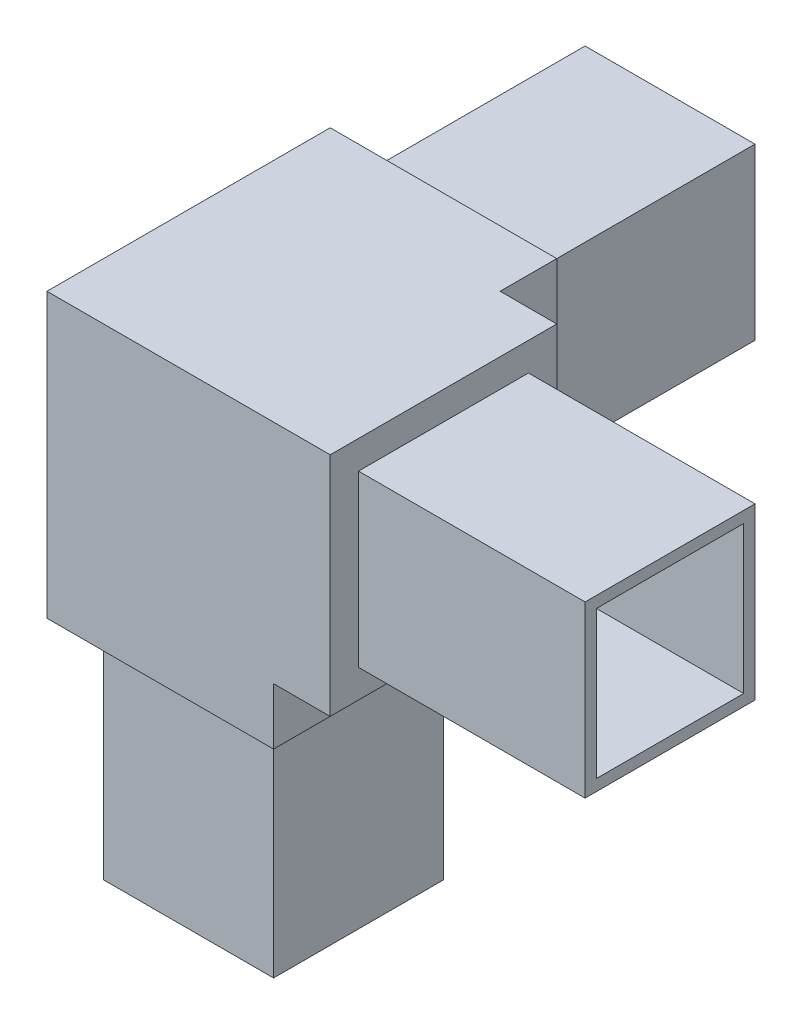
from build123d import *

# Parameters (mm, degrees)
CROQUIS1_W     = 40
CROQUIS1_H     = 50
CROQUIS1_H_2   = 40
CROQUIS1_W_2   = 50
EXTRUIR1_DEPTH = 40
CROQUIS5_W     = 40
CROQUIS5_H     = 40
EXTRUIR4_DEPTH = 50
CROQUIS2_W     = 40
CROQUIS2_H     = 40
CROQUIS2_W_2   = 30
CROQUIS2_H_2   = 30
EXTRUIR2_DEPTH = 40
CROQUIS3_W     = 40
CROQUIS3_H     = 40
CROQUIS3_W_2   = 30
CROQUIS3_H_2   = 30
EXTRUIR3_DEPTH = 40
CROQUIS7_W     = 40
CROQUIS7_H     = 40
CROQUIS7_W_2   = 30
CROQUIS7_H_2   = 30
EXTRUIR5_DEPTH = 40
VACIADO1_T     = -2


with BuildPart() as part:
    # Croquis1 → Extruir1 (new body)
    with BuildSketch(Plane(origin=(0, 0, 0), x_dir=(1, 0, 0), z_dir=(0, 1, 0))):
        with Locations((0, 45)):
            Rectangle(CROQUIS1_W, CROQUIS1_H)
        Rectangle(CROQUIS1_W, CROQUIS1_H_2)
        with Locations((45, 0)):
            Rectangle(CROQUIS1_W_2, CROQUIS1_H_2)
    extrude(amount=EXTRUIR1_DEPTH)

    # Croquis5 → Extruir4 (add)
    with BuildSketch(Plane.XZ):
        Rectangle(CROQUIS5_W, CROQUIS5_H)
    extrude(amount=EXTRUIR4_DEPTH)

    # Croquis2 → Extruir2 (cut)
    with BuildSketch(Plane(origin=(70, 0, 0), x_dir=(0, 0, -1), z_dir=(1, 0, 0))):
        with Locations((0, 20)):
            Rectangle(CROQUIS2_W, CROQUIS2_H)
        with Locations((0, 20)):
            Rectangle(CROQUIS2_W_2, CROQUIS2_H_2, mode=Mode.SUBTRACT)
    extrude(amount=-EXTRUIR2_DEPTH, mode=Mode.SUBTRACT)

    # Croquis3 → Extruir3 (cut)
    with BuildSketch(Plane(origin=(0, 0, -70), x_dir=(-1, 0, 0), z_dir=(0, 0, -1))):
        with Locations((0, 20)):
            Rectangle(CROQUIS3_W, CROQUIS3_H)
        with Locations((0, 20)):
            Rectangle(CROQUIS3_W_2, CROQUIS3_H_2, mode=Mode.SUBTRACT)
    extrude(amount=-EXTRUIR3_DEPTH, mode=Mode.SUBTRACT)

    # Croquis7 → Extruir5 (cut)
    with BuildSketch(Plane.XZ.offset(50)):
        Rectangle(CROQUIS7_W, CROQUIS7_H)
        Rectangle(CROQUIS7_W_2, CROQUIS7_H_2, mode=Mode.SUBTRACT)
    extrude(amount=-EXTRUIR5_DEPTH, mode=Mode.SUBTRACT)

    # Vaciado1
    vaciado1_openings = [part.faces().sort_by_distance(p)[0] for p in [
        (70, 20, 0),
        (0, 20, -70),
        (0, -50, 0),
    ]]
    offset(amount=VACIADO1_T, openings=vaciado1_openings, kind=Kind.INTERSECTION)


solid = part.part
